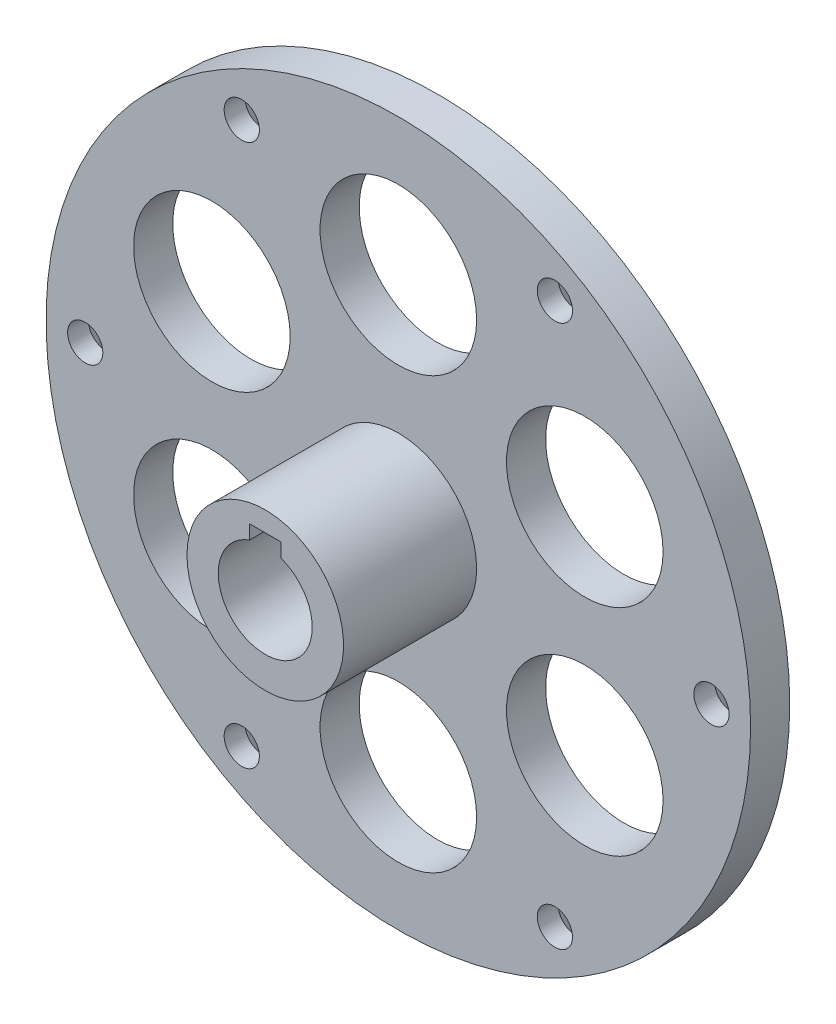
from build123d import *

# Parameters (mm, degrees)
SKETCH1_R                                            = 45
SKETCH1_R_2                                          = 6
EXTRUDE1_DEPTH                                       = 5
SKETCH2_R                                            = 10
SKETCH2_R_2                                          = 6
EXTRUDE2_DEPTH                                       = 22
SKETCH4_R                                            = 10
CUT_EXTRUDE2_DEPTH                                   = 100
SKETCH5_W                                            = 4
SKETCH5_H                                            = 1.8
CUT_EXTRUDE3_DEPTH                                   = 50
SKETCH6_R                                            = 2
CUT_EXTRUDE4_DEPTH                                   = 15
CSK_FOR_M4_HEX_SOCKET_COUNTERSUNK_HEAD_S_D           = 4.5
CSK_FOR_M4_HEX_SOCKET_COUNTERSUNK_HEAD_S_CSINK_D     = 9.18
CSK_FOR_M4_HEX_SOCKET_COUNTERSUNK_HEAD_S_CSINK_ANGLE = 90
CIRPATTERN1_COUNT                                    = 6


with BuildPart() as part:
    # Sketch1 → Extrude1 (new body)
    with BuildSketch(Plane.XY):
        Circle(SKETCH1_R)
        Circle(SKETCH1_R_2, mode=Mode.SUBTRACT)
    extrude(amount=EXTRUDE1_DEPTH)

    # Sketch2 → Extrude2 (add)
    with BuildSketch(Plane(origin=(0, 0, 0), x_dir=(-1, 0, 0), z_dir=(0, 0, -1))):
        Circle(SKETCH2_R)
        Circle(SKETCH2_R_2, mode=Mode.SUBTRACT)
    extrude(amount=-EXTRUDE2_DEPTH)

    # Sketch4 → Cut-Extrude2 (cut)
    with BuildSketch(Plane.XY.offset(5)):
        with Locations((23.815698604, 13.75)):
            Circle(SKETCH4_R)
        with Locations((0, 27.5)):
            Circle(SKETCH4_R)
        with Locations((23.815698604, -13.75)):
            Circle(SKETCH4_R)
        with Locations((0, -27.5)):
            Circle(SKETCH4_R)
        with Locations((-23.815698604, -13.75)):
            Circle(SKETCH4_R)
        with Locations((-23.815698604, 13.75)):
            Circle(SKETCH4_R)
    extrude(amount=-CUT_EXTRUDE2_DEPTH, mode=Mode.SUBTRACT)

    # Sketch5 → Cut-Extrude3 (cut)
    with BuildSketch(Plane.XY.offset(22)):
        with Locations((0, 6.556854249)):
            Rectangle(SKETCH5_W, SKETCH5_H)
    extrude(amount=-CUT_EXTRUDE3_DEPTH, mode=Mode.SUBTRACT)

    # Sketch6 → Cut-Extrude4 (cut)
    with BuildSketch(Plane(origin=(0, 0, 0), x_dir=(-1, 0, 0), z_dir=(0, 0, -1))):
        with Locations((20, 34.641016151)):
            Circle(SKETCH6_R)
    extrude(amount=-CUT_EXTRUDE4_DEPTH, mode=Mode.SUBTRACT)

    # CSK for M4 Hex Socket Countersunk Head Screw1 (through all)
    with Locations(Plane(origin=(-20, 34.641016151, 0), x_dir=(-1, 0, 0), z_dir=(0, 0, -1))):
        with Locations((0, 0)):
            csk_for_m4_hex_socket_countersunk_head_s = CounterSinkHole(CSK_FOR_M4_HEX_SOCKET_COUNTERSUNK_HEAD_S_D / 2, CSK_FOR_M4_HEX_SOCKET_COUNTERSUNK_HEAD_S_CSINK_D / 2, counter_sink_angle=CSK_FOR_M4_HEX_SOCKET_COUNTERSUNK_HEAD_S_CSINK_ANGLE)

    # CirPattern1: CSK for M4 Hex Socket Countersunk Head Screw1 ×6 about axis
    cirpattern1_axis = Axis((0, 0, 22), (0, 0, -1))
    for i in range(1, CIRPATTERN1_COUNT):
        add(csk_for_m4_hex_socket_countersunk_head_s.rotate(cirpattern1_axis, i * 360 / CIRPATTERN1_COUNT), mode=Mode.SUBTRACT)


solid = part.part
